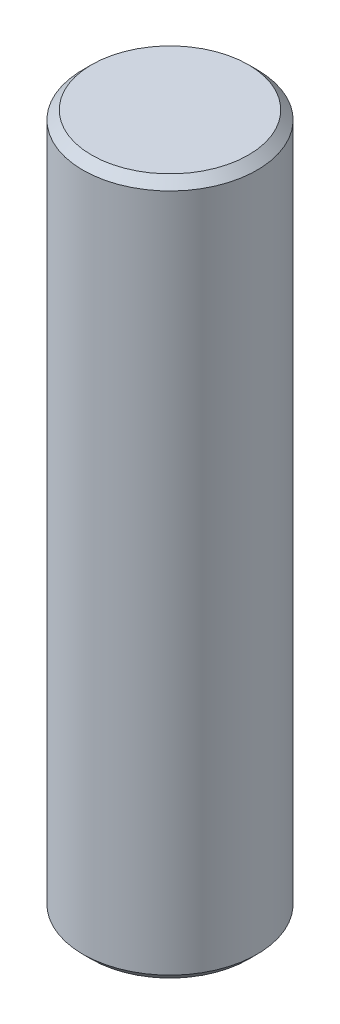
from build123d import *

# Parameters (mm, degrees)
SKETCH1_R           = 1
BOSS_EXTRUDE1_DEPTH = 4
CHAMFER1_SIZE       = 0.1


with BuildPart() as part:
    # Sketch1 → Boss-Extrude1 (new, symmetric)
    with BuildSketch(Plane(origin=(0, 0, 0), x_dir=(1, 0, 0), z_dir=(0, 1, 0))):
        with Locations(Location((0, 0, 0), (0, 0, 270))):
            Circle(SKETCH1_R)
    extrude(amount=BOSS_EXTRUDE1_DEPTH, both=True)

    # Chamfer1
    chamfer1_edges = [part.edges().sort_by_distance(p)[0] for p in [
        (0, -4, -1),
        (0, 4, -1),
    ]]
    chamfer(chamfer1_edges, length=CHAMFER1_SIZE)


solid = part.part
